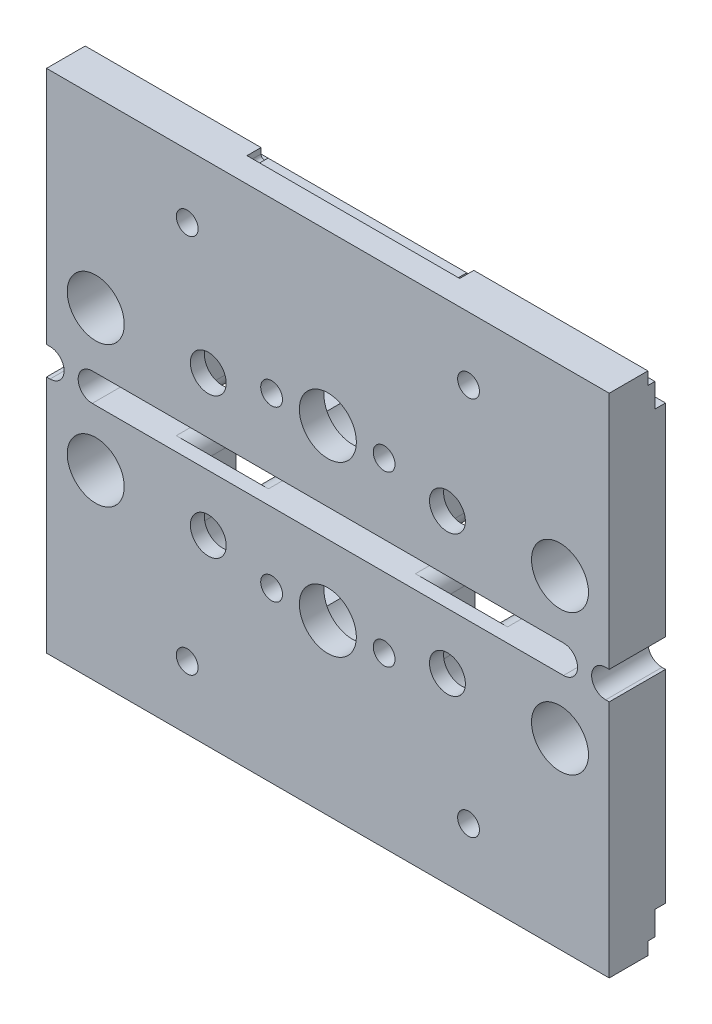
from build123d import *

# Parameters (mm, degrees)
SKETCH_2_W           = 80
SKETCH_2_H           = 34
SKETCH_2_R           = 4.05
EXTRUDE_1_DEPTH      = 8
SKETCH_3_R           = 2.55
CUT_EXTRUDE_1_DEPTH  = 88.292611371
CUT_EXTRUDE_2_DEPTH  = 88.292611371
SKETCH_5_R           = 1.55
CUT_EXTRUDE_3_DEPTH  = 88.292611371
CUT_EXTRUDE_4_DEPTH  = 6
CUT_EXTRUDE_5_DEPTH  = 4.5
SKETCH_20_R          = 5.5
CUT_EXTRUDE_12_DEPTH = 4.5
SKETCH_25_R          = 1.55
CUT_EXTRUDE_13_DEPTH = 88.292611371
CUT_EXTRUDE_11_DEPTH = 2
EXTRUDE_2_DEPTH      = 8


with BuildPart() as part:
    # 草图2 → 凸台-拉伸1 (new body)
    with BuildSketch(Plane.XY):
        with Locations((40, 17)):
            Rectangle(SKETCH_2_W, SKETCH_2_H)
        with Locations((7, 8)):
            Circle(SKETCH_2_R, mode=Mode.SUBTRACT)
        with Locations((40, 10)):
            Circle(SKETCH_2_R, mode=Mode.SUBTRACT)
        with Locations((73, 8)):
            Circle(SKETCH_2_R, mode=Mode.SUBTRACT)
    extrude_1 = extrude(amount=EXTRUDE_1_DEPTH)

    # 草图3 → 切除-拉伸1 (cut, through all)
    with BuildSketch(Plane.XY.offset(8)):
        with Locations((23, 8)):
            Circle(SKETCH_3_R)
        with Locations((57, 8)):
            Circle(SKETCH_3_R)
    cut_extrude_1 = extrude(amount=-CUT_EXTRUDE_1_DEPTH, mode=Mode.SUBTRACT)

    # 草图4 → 切除-拉伸2 (cut, through all)
    with BuildSketch(Plane(origin=(80, 0, 0), x_dir=(0, 0, -1), z_dir=(1, 0, 0))):
        Polygon((-1.5, 32.2), (-2.5, 32.2), (-2.5, 34), (0, 34), (0, 28.8), (-1.5, 28.8), align=None)
    cut_extrude_2 = extrude(amount=-CUT_EXTRUDE_2_DEPTH, mode=Mode.SUBTRACT)

    # 草图5 → 切除-拉伸3 (cut, through all)
    with BuildSketch(Plane.XY.offset(8)):
        with Locations((48, 10)):
            Circle(SKETCH_5_R)
        with Locations((32, 10)):
            Circle(SKETCH_5_R)
    cut_extrude_3 = extrude(amount=-CUT_EXTRUDE_3_DEPTH, mode=Mode.SUBTRACT)

    # 草图7 → 切除-拉伸4 (cut)
    with BuildSketch(Plane(origin=(0, 0, 0), x_dir=(-1, 0, 0), z_dir=(0, 0, -1))):
        with BuildLine():
            Line((-27.05, 10), (-27.05, 2.5))
            ThreePointArc((-27.05, 2.5), (-27.782233047, 0.732233047), (-29.55, 0))
            Line((-29.55, 0), (-16.45, 0))
            ThreePointArc((-16.45, 0), (-18.217766953, 0.732233047), (-18.95, 2.5))
            Line((-18.95, 2.5), (-18.95, 10))
            ThreePointArc((-18.95, 10), (-23, 14.05), (-27.05, 10))
        make_face()
        with BuildLine():
            Line((-61.05, 2.5), (-61.05, 10))
            ThreePointArc((-61.05, 10), (-57, 14.05), (-52.95, 10))
            Line((-52.95, 10), (-52.95, 2.5))
            ThreePointArc((-52.95, 2.5), (-52.217766953, 0.732233047), (-50.45, 0))
            Line((-50.45, 0), (-63.55, 0))
            ThreePointArc((-63.55, 0), (-61.782233047, 0.732233047), (-61.05, 2.5))
        make_face()
    cut_extrude_4 = extrude(amount=-CUT_EXTRUDE_4_DEPTH, mode=Mode.SUBTRACT)

    # 草图8 → 切除-拉伸5 (cut)
    with BuildSketch(Plane(origin=(0, 0, 0), x_dir=(-1, 0, 0), z_dir=(0, 0, -1))):
        with BuildLine():
            Line((-30.5, 12.85), (-49.5, 12.85))
            ThreePointArc((-49.5, 12.85), (-52.35, 10), (-49.5, 7.15))
            Line((-49.5, 7.15), (-30.5, 7.15))
            ThreePointArc((-30.5, 7.15), (-27.65, 10), (-30.5, 12.85))
        make_face()
    cut_extrude_5 = extrude(amount=-CUT_EXTRUDE_5_DEPTH, mode=Mode.SUBTRACT)

    # 草图20 → 切除-拉伸12 (cut)
    with BuildSketch(Plane(origin=(0, 0, 0), x_dir=(-1, 0, 0), z_dir=(0, 0, -1))):
        with Locations((-40, 10)):
            Circle(SKETCH_20_R)
    cut_extrude_12 = extrude(amount=-CUT_EXTRUDE_12_DEPTH, mode=Mode.SUBTRACT)

    # 草图25 → 切除-拉伸13 (cut, through all)
    with BuildSketch(Plane(origin=(0, 0, 0), x_dir=(-1, 0, 0), z_dir=(0, 0, -1))):
        with Locations((-60, 25)):
            Circle(SKETCH_25_R)
        with Locations((-20, 25)):
            Circle(SKETCH_25_R)
    cut_extrude_13 = extrude(amount=-CUT_EXTRUDE_13_DEPTH, mode=Mode.SUBTRACT)

    # 草图19 → 切除-拉伸11 (cut)
    with BuildSketch(Plane(origin=(0, 0, 2.5), x_dir=(-1, 0, 0), z_dir=(0, 0, -1))):
        with BuildLine():
            Line((-25, 34), (-55.247938178, 34))
            Line((-55.247938178, 34), (-55.247938178, 33.2))
            ThreePointArc((-55.247938178, 33.2), (-54.747938178, 32.7), (-54.247938178, 33.2))
            Line((-54.247938178, 33.2), (-26, 33.2))
            ThreePointArc((-26, 33.2), (-25.5, 32.7), (-25, 33.2))
            Line((-25, 33.2), (-25, 34))
        make_face()
    cut_extrude_11 = extrude(amount=-CUT_EXTRUDE_11_DEPTH, mode=Mode.SUBTRACT)

    # 草图22 → 凸台-拉伸2 (add)
    with BuildSketch(Plane.XY.offset(8)):
        with BuildLine():
            Line((0.5, -4), (6.5, -4))
            ThreePointArc((6.5, -4), (4.5, -2), (6.5, 0))
            Line((6.5, 0), (0.5, 0))
            ThreePointArc((0.5, 0), (2.5, -2), (0.5, -4))
        make_face()
        with BuildLine():
            Line((79.5, 0), (73.5, 0))
            ThreePointArc((73.5, 0), (75.5, -2), (73.5, -4))
            Line((73.5, -4), (79.5, -4))
            ThreePointArc((79.5, -4), (77.5, -2), (79.5, 0))
        make_face()
    extrude(amount=-EXTRUDE_2_DEPTH)

    # 镜向2: 凸台-拉伸1, 切除-拉伸1, 切除-拉伸2, 切除-拉伸3, 切除-拉伸4, 切除-拉伸5, 切除-拉伸12, 切除-拉伸13, 切除-拉伸11 across plane
    add(extrude_1.mirror(Plane(origin=(0, -2, 0), x_dir=(0, 0, 1), z_dir=(0, -1, 0))))
    add(cut_extrude_1.mirror(Plane(origin=(0, -2, 0), x_dir=(0, 0, 1), z_dir=(0, -1, 0))), mode=Mode.SUBTRACT)
    add(cut_extrude_2.mirror(Plane(origin=(0, -2, 0), x_dir=(0, 0, 1), z_dir=(0, -1, 0))), mode=Mode.SUBTRACT)
    add(cut_extrude_3.mirror(Plane(origin=(0, -2, 0), x_dir=(0, 0, 1), z_dir=(0, -1, 0))), mode=Mode.SUBTRACT)
    add(cut_extrude_4.mirror(Plane(origin=(0, -2, 0), x_dir=(0, 0, 1), z_dir=(0, -1, 0))), mode=Mode.SUBTRACT)
    add(cut_extrude_5.mirror(Plane(origin=(0, -2, 0), x_dir=(0, 0, 1), z_dir=(0, -1, 0))), mode=Mode.SUBTRACT)
    add(cut_extrude_12.mirror(Plane(origin=(0, -2, 0), x_dir=(0, 0, 1), z_dir=(0, -1, 0))), mode=Mode.SUBTRACT)
    add(cut_extrude_13.mirror(Plane(origin=(0, -2, 0), x_dir=(0, 0, 1), z_dir=(0, -1, 0))), mode=Mode.SUBTRACT)
    add(cut_extrude_11.mirror(Plane(origin=(0, -2, 0), x_dir=(0, 0, 1), z_dir=(0, -1, 0))), mode=Mode.SUBTRACT)


solid = part.part
